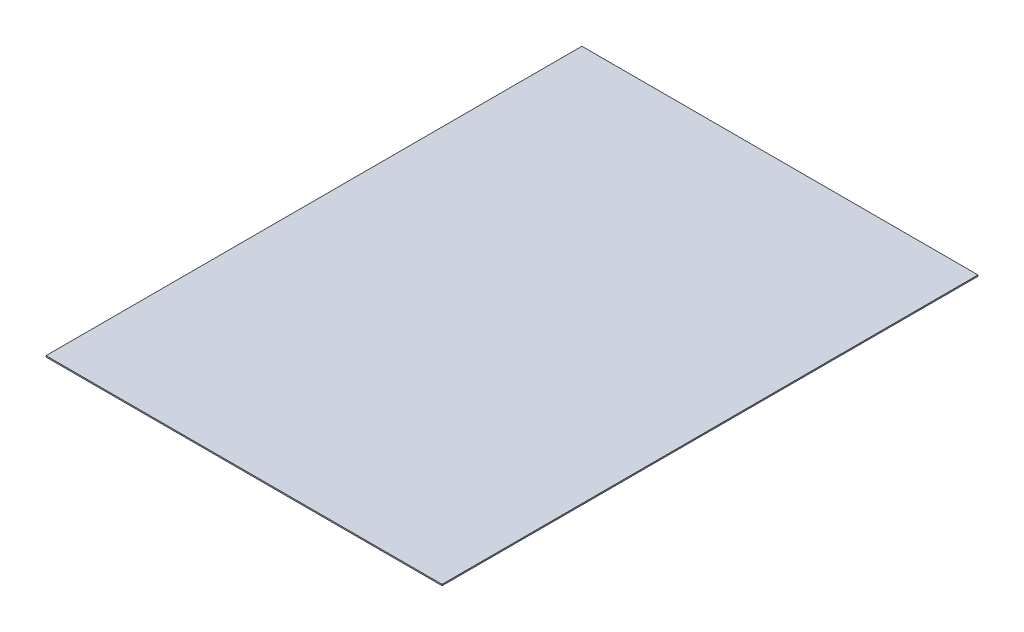
from build123d import *

# Parameters (mm, degrees)
SKETCH1_W           = 170
SKETCH1_H           = 230
BOSS_EXTRUDE1_DEPTH = 0.535


with BuildPart() as part:
    # Sketch1 → Boss-Extrude1 (new body)
    with BuildSketch(Plane(origin=(0, 0, 0), x_dir=(1, 0, 0), z_dir=(0, 1, 0))):
        Rectangle(SKETCH1_W, SKETCH1_H)
    extrude(amount=BOSS_EXTRUDE1_DEPTH)


solid = part.part
